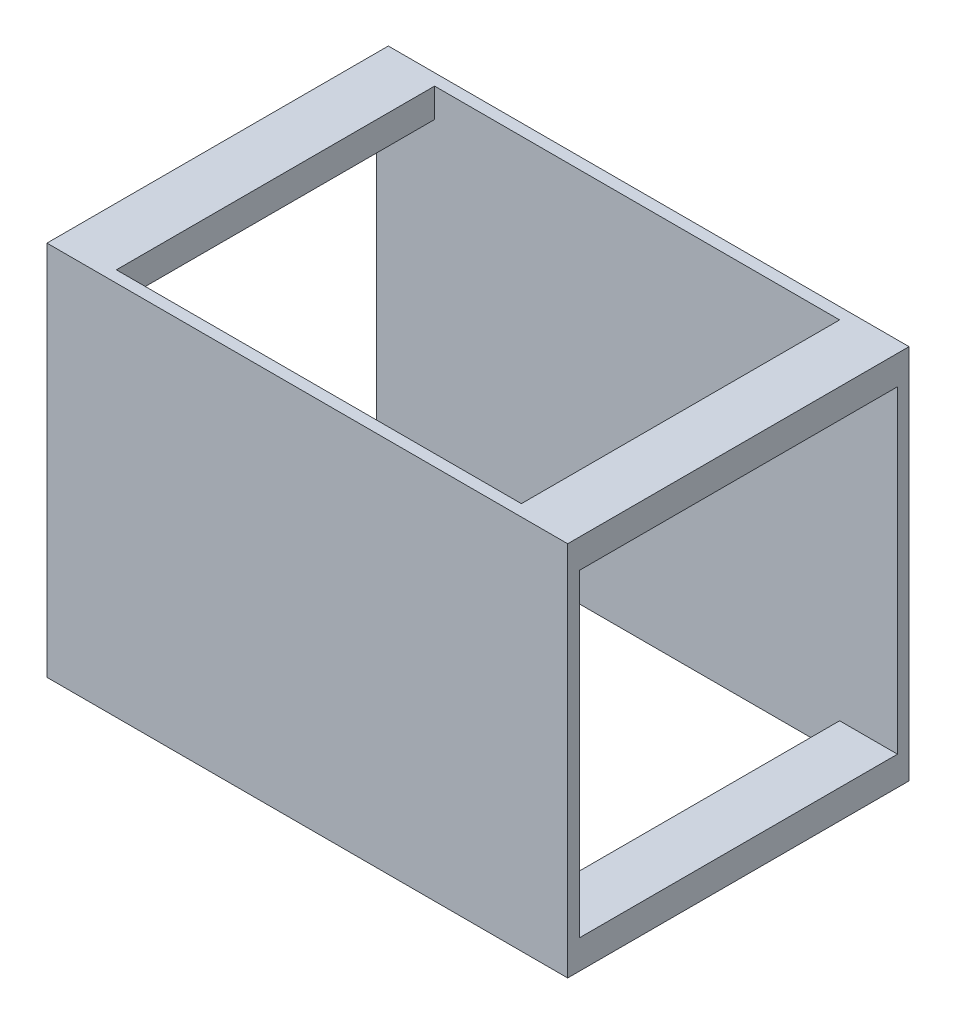
from build123d import *

# Parameters (mm, degrees)
SKETCH1_W                                  = 90
SKETCH1_H                                  = 65
BOSS_EXTRUDE1_DEPTH                        = 2
SKETCH2_W                                  = 10
SKETCH2_H                                  = 5
BOSS_EXTRUDE2_DEPTH                        = 55
MIRROR1_AT_THE_SECOND_PLANE_COPY_1_SKETC_W = 10
MIRROR1_AT_THE_SECOND_PLANE_COPY_1_SKETC_H = 5
MIRROR1_AT_THE_SECOND_PLANE_COPY_1_DEPTH   = 55
SKETCH3_W                                  = 90
SKETCH3_H                                  = 65
BOSS_EXTRUDE3_DEPTH                        = 2


with BuildPart() as part:
    # Sketch1 → Boss-Extrude1 (new body)
    with BuildSketch(Plane.XY):
        Rectangle(SKETCH1_W, SKETCH1_H)
    extrude(amount=BOSS_EXTRUDE1_DEPTH)

    # Sketch2 → Boss-Extrude2 (add)
    with BuildSketch(Plane.XY.offset(2)):
        with Locations((-40, 30)):
            Rectangle(SKETCH2_W, SKETCH2_H)
    boss_extrude2 = extrude(amount=BOSS_EXTRUDE2_DEPTH)

    # Mirror1: Boss-Extrude2 across plane
    add(boss_extrude2.mirror(Plane(origin=(0, 0, 0), x_dir=(0, 0, 1), z_dir=(1, 0, 0))))

    # Mirror1 at the second plane: Boss-Extrude2 across plane
    add(boss_extrude2.mirror(Plane.ZX))

    # Mirror1 at the second plane copy 1 sketc → Mirror1 at the second plane copy 1 (add)
    with BuildSketch(Plane(origin=(0, 0, 2), x_dir=(-1, 0, 0), z_dir=(0, 0, 1))):
        with Locations((-40, 30)):
            Rectangle(MIRROR1_AT_THE_SECOND_PLANE_COPY_1_SKETC_W, MIRROR1_AT_THE_SECOND_PLANE_COPY_1_SKETC_H)
    extrude(amount=MIRROR1_AT_THE_SECOND_PLANE_COPY_1_DEPTH)

    # Sketch3 → Boss-Extrude3 (add)
    with BuildSketch(Plane.XY.offset(57)):
        Rectangle(SKETCH3_W, SKETCH3_H)
    extrude(amount=BOSS_EXTRUDE3_DEPTH)


solid = part.part
